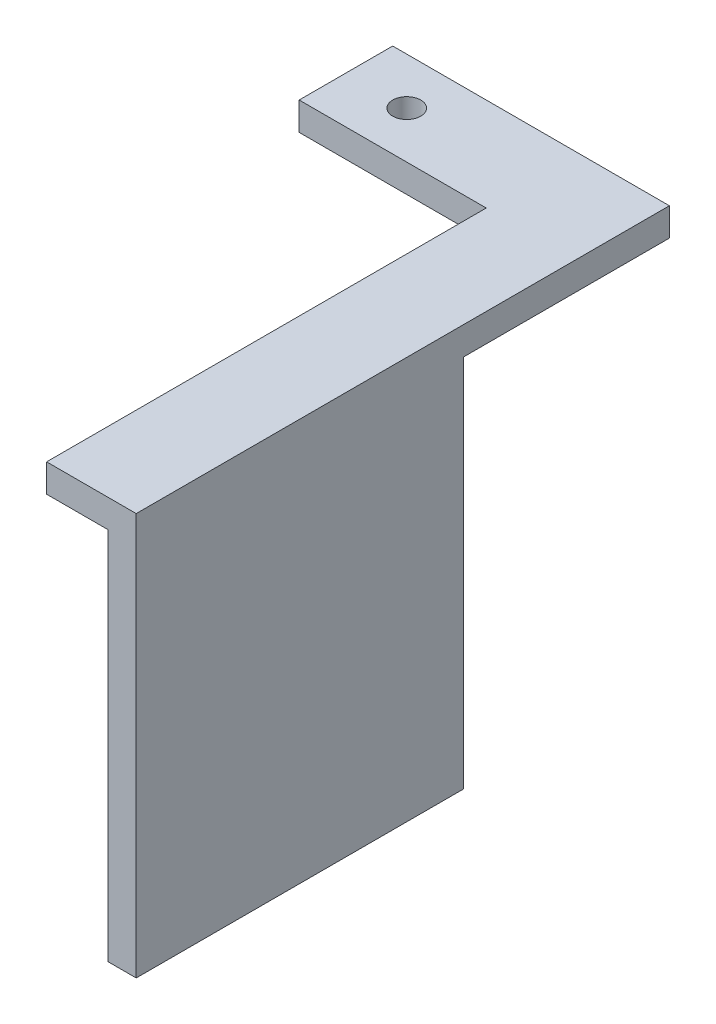
from build123d import *

# Parameters (mm, degrees)
BOSS_EXTRUDE1_DEPTH = 3
SKETCH2_R           = 1.5
CUT_EXTRUDE1_DEPTH  = 3
SKETCH3_W           = 3
SKETCH3_H           = 35
BOSS_EXTRUDE2_DEPTH = 40


with BuildPart() as part:
    # Sketch1 → Boss-Extrude1 (new body)
    with BuildSketch(Plane(origin=(0, 0, 0), x_dir=(1, 0, 0), z_dir=(0, 1, 0))):
        Polygon((10, -5), (10, -52), (19.57850172, -52), (19.57850172, 5), (10, 5), (-10, 5), (-10, -5), align=None)
    extrude(amount=BOSS_EXTRUDE1_DEPTH)

    # Sketch2 → Cut-Extrude1 (cut)
    with BuildSketch(Plane(origin=(0, 3, 0), x_dir=(1, 0, 0), z_dir=(0, 1, 0))):
        with Locations(Location((-3.5, 0, 0), (0, 0, 270))):
            Circle(SKETCH2_R)
    extrude(amount=-CUT_EXTRUDE1_DEPTH, mode=Mode.SUBTRACT)

    # Sketch3 → Boss-Extrude2 (add)
    with BuildSketch(Plane.XZ):
        with Locations((18.07850172, 34.5)):
            Rectangle(SKETCH3_W, SKETCH3_H)
    extrude(amount=BOSS_EXTRUDE2_DEPTH)


solid = part.part
